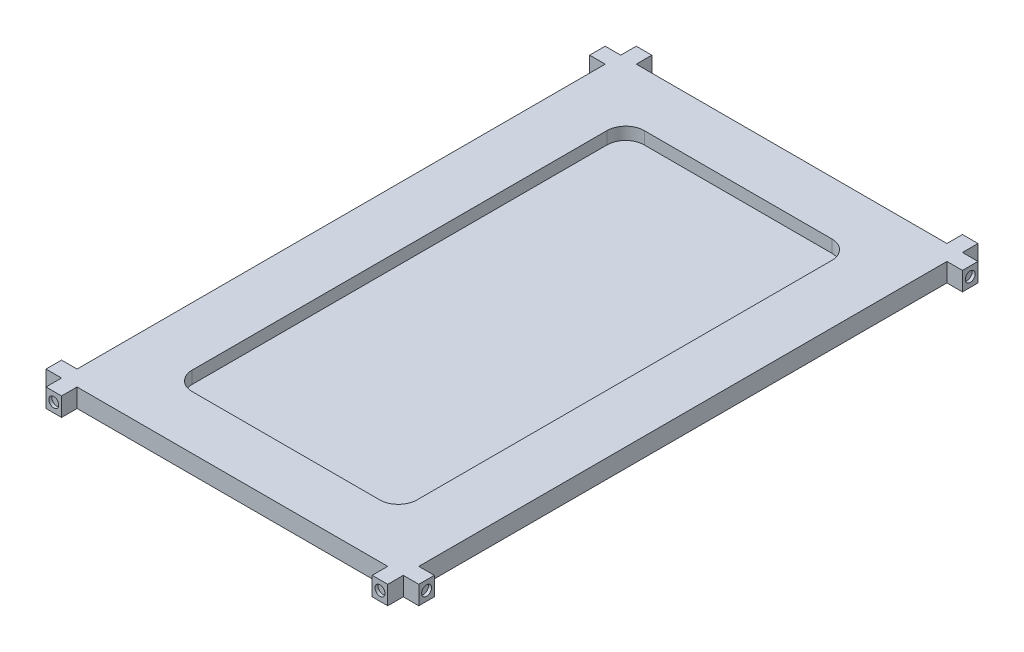
from build123d import *

# Parameters (mm, degrees)
EXTRUDE_1_DEPTH          = 10
EXTRUDE_1_DEPTH_BACK     = 20
SKETCH_1_W               = 550
SKETCH_1_H               = 900
CUT_EXTRUDE_4_DEPTH      = 20
SKETCH_7_R               = 50
CUT_EXTRUDE_5_DEPTH      = 5
SKETCH_8_W               = 25
SKETCH_8_H               = 25
EXTRUDE_2_DEPTH          = 30
SKETCH_9_R               = 8
CUT_EXTRUDE_6_DEPTH      = 5
SKETCH_10_R              = 8
CUT_EXTRUDE_7_DEPTH      = 5
MIRROR_2_COPY_1_SKETCH_W = 25
MIRROR_2_COPY_1_SKETCH_H = 25
MIRROR_2_COPY_1_DEPTH    = 30
MIRROR_2_COPY_2_SKETCH_R = 8
MIRROR_2_COPY_2_DEPTH    = 5
MIRROR_2_COPY_3_SKETCH_R = 8
MIRROR_2_COPY_3_DEPTH    = 5


with BuildPart() as part:
    # 草图1 → 凸台-拉伸1 (new, two sides: drawn at the far end of the back side and taken through both)
    with BuildSketch(Plane(origin=(0, 0, 0), x_dir=(1, 0, 0), z_dir=(0, 1, 0)).offset(-EXTRUDE_1_DEPTH_BACK)):
        Rectangle(SKETCH_1_W, SKETCH_1_H)
    extrude(amount=EXTRUDE_1_DEPTH + EXTRUDE_1_DEPTH_BACK)

    # 草图6 → 切除-拉伸4 (cut)
    with BuildSketch(Plane(origin=(0, 10, 0), x_dir=(1, 0, 0), z_dir=(0, 1, 0))):
        with BuildLine():
            Line((-150.934743828, 363.792707869), (150.934743828, 363.792707869))
            ThreePointArc((150.934743828, 363.792707869), (172.147947264, 355.005911305), (180.934743828, 333.792707869))
            Line((180.934743828, 333.792707869), (180.934743828, -333.792707869))
            ThreePointArc((180.934743828, -333.792707869), (172.147947264, -355.005911305), (150.934743828, -363.792707869))
            Line((150.934743828, -363.792707869), (-150.934743828, -363.792707869))
            ThreePointArc((-150.934743828, -363.792707869), (-172.147947264, -355.005911305), (-180.934743828, -333.792707869))
            Line((-180.934743828, -333.792707869), (-180.934743828, 333.792707869))
            ThreePointArc((-180.934743828, 333.792707869), (-172.147947264, 355.005911305), (-150.934743828, 363.792707869))
        make_face()
    extrude(amount=-CUT_EXTRUDE_4_DEPTH, mode=Mode.SUBTRACT)

    # 草图7 → 切除-拉伸5 (cut)
    with BuildSketch(Plane.XZ.offset(20)):
        with Locations(Location((-215, 300, 0), (0, 0, 270))):
            Circle(SKETCH_7_R)
        with Locations(Location((-215, -300, 0), (0, 0, 90))):
            Circle(SKETCH_7_R)
        with Locations(Location((215, -300, 0), (0, 0, 270))):
            Circle(SKETCH_7_R)
        with Locations(Location((215, 300, 0), (0, 0, 90))):
            Circle(SKETCH_7_R)
    extrude(amount=-CUT_EXTRUDE_5_DEPTH, mode=Mode.SUBTRACT)

    # 草图8 → 凸台-拉伸2 (add)
    with BuildSketch(Plane.XZ.offset(20)):
        with Locations((-262.5, -462.5)):
            Rectangle(SKETCH_8_W, SKETCH_8_H)
        with Locations((-287.5, -437.5)):
            Rectangle(SKETCH_8_W, SKETCH_8_H)
    extrude_2 = extrude(amount=-EXTRUDE_2_DEPTH)

    # 草图9 → 切除-拉伸6 (cut)
    with BuildSketch(Plane.ZY.offset(300)):
        with Locations((-437.5, -5)):
            Circle(SKETCH_9_R)
    cut_extrude_6 = extrude(amount=-CUT_EXTRUDE_6_DEPTH, mode=Mode.SUBTRACT)

    # 草图10 → 切除-拉伸7 (cut)
    with BuildSketch(Plane(origin=(0, 0, -475), x_dir=(-1, 0, 0), z_dir=(0, 0, -1))):
        with Locations((262.5, -5)):
            Circle(SKETCH_10_R)
    cut_extrude_7 = extrude(amount=-CUT_EXTRUDE_7_DEPTH, mode=Mode.SUBTRACT)

    # 镜向1: 凸台-拉伸2, 切除-拉伸6, 切除-拉伸7 across plane
    add(extrude_2.mirror(Plane(origin=(0, 0, 0), x_dir=(0, 0, 1), z_dir=(1, 0, 0))))
    add(cut_extrude_6.mirror(Plane(origin=(0, 0, 0), x_dir=(0, 0, 1), z_dir=(1, 0, 0))), mode=Mode.SUBTRACT)
    add(cut_extrude_7.mirror(Plane(origin=(0, 0, 0), x_dir=(0, 0, 1), z_dir=(1, 0, 0))), mode=Mode.SUBTRACT)

    # 镜向2: 凸台-拉伸2, 切除-拉伸6, 切除-拉伸7 across plane
    add(extrude_2.mirror(Plane.XY))
    add(cut_extrude_6.mirror(Plane.XY), mode=Mode.SUBTRACT)
    add(cut_extrude_7.mirror(Plane.XY), mode=Mode.SUBTRACT)

    # 镜向2 copy 1 sketch → 镜向2 copy 1 (add)
    with BuildSketch(Plane(origin=(0, -20, 0), x_dir=(-1, 0, 0), z_dir=(0, -1, 0))):
        with Locations((-262.5, -462.5)):
            Rectangle(MIRROR_2_COPY_1_SKETCH_W, MIRROR_2_COPY_1_SKETCH_H)
        with Locations((-287.5, -437.5)):
            Rectangle(MIRROR_2_COPY_1_SKETCH_W, MIRROR_2_COPY_1_SKETCH_H)
    extrude(amount=-MIRROR_2_COPY_1_DEPTH)

    # 镜向2 copy 2 sketch → 镜向2 copy 2 (cut)
    with BuildSketch(Plane(origin=(300, 0, 0), x_dir=(0, 0, -1), z_dir=(1, 0, 0))):
        with Locations((-437.5, -5)):
            Circle(MIRROR_2_COPY_2_SKETCH_R)
    extrude(amount=-MIRROR_2_COPY_2_DEPTH, mode=Mode.SUBTRACT)

    # 镜向2 copy 3 sketch → 镜向2 copy 3 (cut)
    with BuildSketch(Plane.XY.offset(475)):
        with Locations((262.5, -5)):
            Circle(MIRROR_2_COPY_3_SKETCH_R)
    extrude(amount=-MIRROR_2_COPY_3_DEPTH, mode=Mode.SUBTRACT)


solid = part.part
